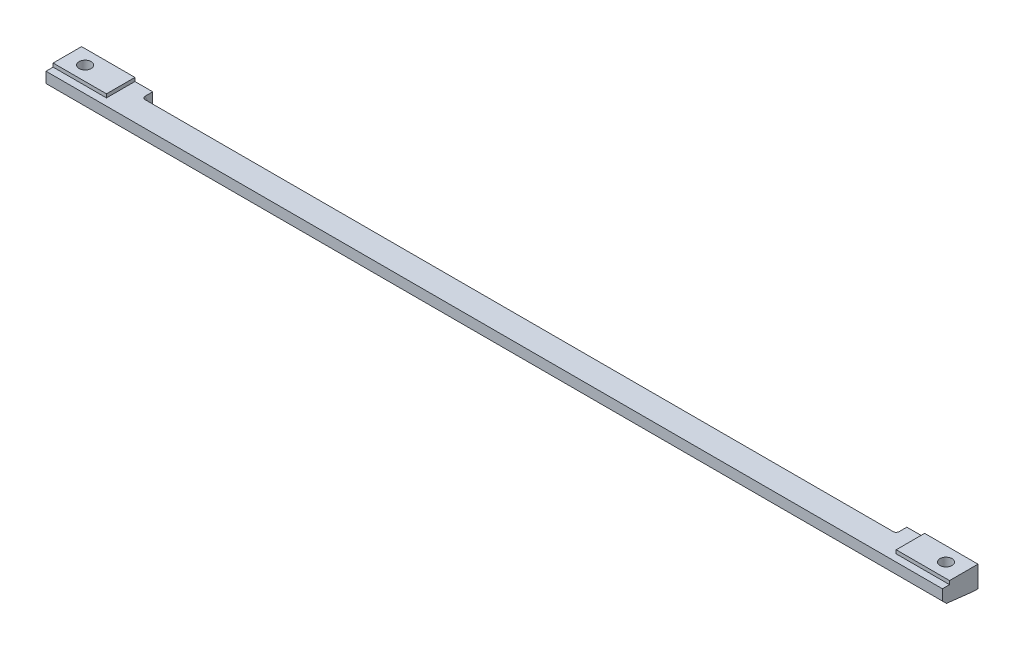
from build123d import *

# Parameters (mm, degrees)
EXTRUDE_1_DEPTH             = 10
CUT_EXTRUDE_1_DEPTH         = 106
FILLET_1_R                  = 0.8
CUT_EXTRUDE_2_DEPTH         = 253.269696951
CHAMFER_1_SIZE              = 1
CHAMFER_1_SIZE2             = 1.137309439
SKETCH_7_W                  = 15
SKETCH_7_H                  = 2
CUT_EXTRUDE_3_DEPTH         = 1
HOLE_WIZARD_M21_D           = 1.6
HOLE_WIZARD_M21_DEPTH       = 6
HOLE_WIZARD_M21_CSINK_D     = 2.05
HOLE_WIZARD_M21_CSINK_ANGLE = 120
HOLE_WIZARD_M21_TIP         = 0.480688495
HOLE_WIZARD_M31_D           = 3.4
HOLE_WIZARD_M31_CBORE_D     = 6.5
HOLE_WIZARD_M31_CBORE_DEPTH = 3.6


with BuildPart() as part:
    # Эскиз1 → Бобышка-Вытянуть1 (new body)
    with BuildSketch(Plane.XY):
        Polygon((-126, 0), (126, 0), (126, 6), (111, 6), (111, 5), (-111, 5), (-111, 6), (-126, 6), align=None)
    extrude(amount=EXTRUDE_1_DEPTH)

    # Эскиз5 → Вырез-Вытянуть1 (cut, symmetric)
    with BuildSketch(Plane(origin=(0, 0, 0), x_dir=(0, 0, -1), z_dir=(1, 0, 0))):
        Polygon((0, 0), (-0.8, 0), (-3, 5), (0, 5), align=None)
    extrude(amount=CUT_EXTRUDE_1_DEPTH, both=True, mode=Mode.SUBTRACT)

    # Скругление1
    fillet_1_edges = [part.edges().sort_by_distance(p)[0] for p in [
        (-106, 2.5, 1.9),
        (106, 2.5, 1.9),
    ]]
    fillet(fillet_1_edges, radius=FILLET_1_R)

    # Эскиз6 → Вырез-Вытянуть2 (cut, through all)
    with BuildSketch(Plane.ZY.offset(126)):
        Polygon((1.3, 0), (10, 1), (10, 0), align=None)
    extrude(amount=-CUT_EXTRUDE_2_DEPTH, mode=Mode.SUBTRACT)

    # Фаска1
    chamfer_1_edges = [part.edges().sort_by_distance(p)[0] for p in [
        (0, 1, 10),
    ]]
    chamfer_1_side = [part.faces().sort_by_distance(p)[0] for p in [
        (0, 3.072254335, 10),
    ]]
    chamfer(chamfer_1_edges, length=CHAMFER_1_SIZE, length2=CHAMFER_1_SIZE2, reference=chamfer_1_side[0])

    # Эскиз7 → Вырез-Вытянуть3 (cut)
    with BuildSketch(Plane(origin=(0, 6, 0), x_dir=(1, 0, 0), z_dir=(0, 1, 0))):
        with Locations((-118.5, -9)):
            Rectangle(SKETCH_7_W, SKETCH_7_H)
        with Locations((118.5, -9)):
            Rectangle(SKETCH_7_W, SKETCH_7_H)
    extrude(amount=-CUT_EXTRUDE_3_DEPTH, mode=Mode.SUBTRACT)

    # Отверстие обработанное метчиком M21
    with Locations(Plane(origin=(0, 0, 0), x_dir=(-1, 0, 0), z_dir=(0, 0, -1))):
        with Locations((-116, 3.5), (116, 3.5)):
            CounterSinkHole(HOLE_WIZARD_M21_D / 2, HOLE_WIZARD_M21_CSINK_D / 2, depth=HOLE_WIZARD_M21_DEPTH, counter_sink_angle=HOLE_WIZARD_M21_CSINK_ANGLE)
            with Locations((0, 0, -(HOLE_WIZARD_M21_DEPTH + HOLE_WIZARD_M21_TIP / 2))):  # 118° drill point
                Cone(0, HOLE_WIZARD_M21_D / 2, HOLE_WIZARD_M21_TIP, mode=Mode.SUBTRACT)

    # Цековка для  винта с внутренним шестигранником M31 (through all)
    with Locations(Plane.XZ):
        with Locations((121, 4), (-121, 4)):
            CounterBoreHole(HOLE_WIZARD_M31_D / 2, HOLE_WIZARD_M31_CBORE_D / 2, HOLE_WIZARD_M31_CBORE_DEPTH)


solid = part.part
